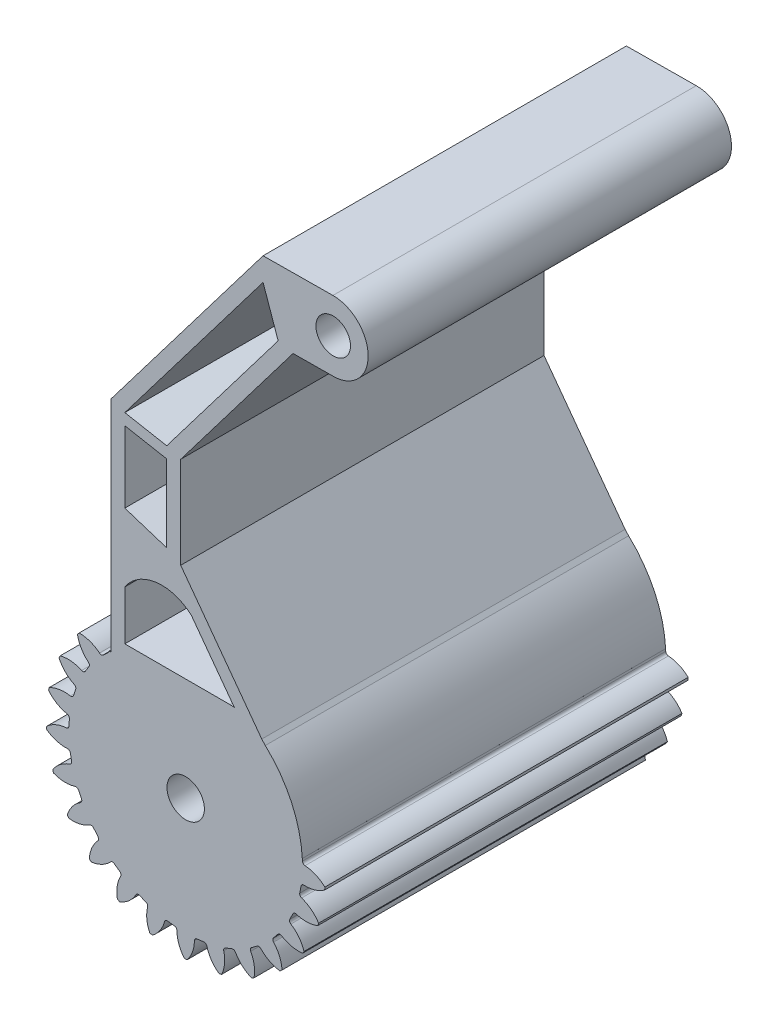
from build123d import *

# Parameters (mm, degrees)
SKETCH1_R                = 12.665001162
BOSS_EXTRUDE1_DEPTH      = 16.51
CUT_EXTRUDE1_DEPTH       = 25.359487041
FILLET1_R                = 0.255000023
CIRPATTERN1_COUNT        = 25
FILLET1_OF_CIRPATTERN1_R = 0.255000023
M3_CLEARANCE_HOLE1_D     = 3.4
SKETCH7_W                = 15.433030704
SKETCH7_H                = 5.386211439
CUT_EXTRUDE2_DEPTH       = 38.558904548
CLAW_PART_DEPTH          = 16.51
CLAW_PART_DEPTH_BACK     = 16.51
SKETCH8_R                = 1.57
CUT_EXTRUDE3_DEPTH       = 60.207872969


with BuildPart() as part:
    # Sketch1 → Boss-Extrude1 (new, symmetric)
    with BuildSketch(Plane.XY):
        Circle(SKETCH1_R)
    extrude(amount=BOSS_EXTRUDE1_DEPTH, both=True)

    # Sketch3 → Cut-Extrude1 (cut, symmetric)
    with BuildSketch(Plane.XY):
        with BuildLine():
            Line((-0.549568511, 10.61077849), (0.549568511, 10.61077849))
            ThreePointArc((0.549568511, 10.61077849), (1.298156627, 12.409330788), (3.016068488, 13.328000136))
            ThreePointArc((3.016068488, 13.328000136), (0, 13.665001162), (-3.016068488, 13.328000136))
            ThreePointArc((-3.016068488, 13.328000136), (-1.298156627, 12.409330788), (-0.549568511, 10.61077849))
        make_face()
    cut_extrude1 = extrude(amount=CUT_EXTRUDE1_DEPTH, both=True, mode=Mode.SUBTRACT)

    # Fillet1
    fillet1_edges = [part.edges().sort_by_distance(p)[0] for p in [
        (-0.549568511, 10.61077849, 0),
        (0.549568511, 10.61077849, 0),
    ]]
    fillet(fillet1_edges, radius=FILLET1_R)

    # CirPattern1: Cut-Extrude1 ×25 about axis, 7 skipped
    cirpattern1_axis = Axis((0, 0, 16.51), (0, 0, 1))
    add([cut_extrude1.rotate(cirpattern1_axis, i * 360 / CIRPATTERN1_COUNT) for i in range(1, CIRPATTERN1_COUNT) if i not in (1, 2, 20, 21, 22, 23, 24)], mode=Mode.SUBTRACT)

    # Fillet1 of CirPattern1
    fillet1_of_cirpattern1_edges = [part.edges().sort_by_distance(p)[0] for p in [
        (-7.66419591, 7.358719098, 0),
        (-6.862959504, 8.111130166, 0),
        (-9.253450125, 5.22152339, 0),
        (-8.664503057, 6.149555472, 0),
        (-10.261276036, 2.756240163, 0),
        (-9.921624017, 3.801581591, 0),
        (-10.624348235, 0.117772231, 0),
        (-10.55533285, 1.214740357, 0),
        (-10.319853561, -2.528095764, 0),
        (-10.525811301, -1.44842748, 0),
        (-9.366924534, -5.015114205, 0),
        (-9.834914317, -4.020585292, 0),
        (-7.82543719, -7.187014575, 0),
        (-8.526053496, -6.340114944, 0),
        (-5.792248847, -8.907328388, 0),
        (-6.681469377, -8.261271856, 0),
        (-3.395112206, -10.067962, 0),
        (-4.417063965, -9.663342675, 0),
        (-0.784648179, -10.595988531, 0),
        (-1.875118178, -10.458230134, 0),
        (1.875118178, -10.458230134, 0),
        (0.784648179, -10.595988531, 0),
        (4.417063965, -9.663342675, 0),
        (3.395112206, -10.067962, 0),
        (6.681469377, -8.261271856, 0),
        (5.792248847, -8.907328388, 0),
        (8.526053496, -6.340114944, 0),
        (7.82543719, -7.187014575, 0),
        (9.834914317, -4.020585292, 0),
        (9.366924534, -5.015114205, 0),
        (10.525811301, -1.44842748, 0),
        (10.319853561, -2.528095764, 0),
        (10.55533285, 1.214740357, 0),
        (10.624348235, 0.117772231, 0),
    ]]
    fillet(fillet1_of_cirpattern1_edges, radius=FILLET1_OF_CIRPATTERN1_R)

    # M3 Clearance Hole1 (through all)
    with Locations(Plane.XY.offset(16.51)):
        with Locations((0, 0)):
            Hole(M3_CLEARANCE_HOLE1_D / 2)

    # Sketch7 → Cut-Extrude2 (cut, through all)
    with BuildSketch(Plane.XY.offset(16.51)):
        with Locations((0.047493999, 10.802685467)):
            Rectangle(SKETCH7_W, SKETCH7_H)
    extrude(amount=-CUT_EXTRUDE2_DEPTH, mode=Mode.SUBTRACT)

    # Sketch8 → claw part (add, two sides: drawn at the far end of the back side and taken through both)
    with BuildSketch(Plane.XY.offset(-CLAW_PART_DEPTH_BACK)):
        with BuildLine():
            Line((3.992994947, 8.109579748), (-6.802497273, 8.109579748))
            Line((-6.802497273, 8.109579748), (-6.802497273, 28.011546875))
            Line((-6.802497273, 28.011546875), (7.032646368, 46.209579748))
            Line((7.032646368, 46.209579748), (13.382646368, 46.262410098))
            ThreePointArc((13.382646368, 46.262410098), (16.583950751, 43.113934237), (13.43547489, 39.912629854))
            Line((13.43547489, 39.912629854), (9.759859293, 39.882049687))
            Line((9.759859293, 39.882049687), (-0.452497273, 26.449243689))
            Line((-0.452497273, 26.449243689), (-0.452497273, 18.105340478))
            Line((-0.452497273, 18.105340478), (7.032646368, 7.951783594))
            Line((7.032646368, 7.951783594), (3.992994947, 8.109579748))
        make_face()
        with Locations((13.409060629, 43.087519976)):
            Circle(SKETCH8_R, mode=Mode.SUBTRACT)
        with BuildLine():
            Line((-5.532497273, 9.379579748), (-5.532497273, 13.862489028))
            ThreePointArc((-5.532497273, 13.862489028), (-2.677856166, 15.64723367), (0.531514386, 14.630262706))
            Line((0.531514386, 14.630262706), (4.417263537, 9.35926499))
            Line((4.417263537, 9.35926499), (4.025937257, 9.379579748))
            Line((4.025937257, 9.379579748), (-5.532497273, 9.379579748))
        make_face(mode=Mode.SUBTRACT)
        Polygon((-5.532497273, 27.583600596), (7.032646368, 44.111141108), (8.405146513, 40.198569154), (-1.722497273, 26.877189969), align=None, mode=Mode.SUBTRACT)
        Polygon((-1.722497273, 25.843874151), (-1.722497273, 18.840272222), (-5.532497273, 20.064062183), (-5.532497273, 26.550284777), align=None, mode=Mode.SUBTRACT)
    extrude(amount=CLAW_PART_DEPTH + CLAW_PART_DEPTH_BACK)

    # Sketch9 → Cut-Extrude3 (cut, through all)
    with BuildSketch(Plane.XY.offset(16.51)):
        with BuildLine():
            Line((6.916319953, 8.109579748), (7.234748251, 7.761896541))
            ThreePointArc((7.234748251, 7.761896541), (9.616723385, 4.484111006), (10.596386978, 0.552451967))
            Line((10.596386978, 0.552451967), (13.513134005, 1.97023997))
            Line((13.513134005, 1.97023997), (13.760629426, 4.432819406))
            Line((13.760629426, 4.432819406), (7.95686181, 10.69445355))
            Line((7.95686181, 10.69445355), (6.916319953, 8.109579748))
        make_face()
    extrude(amount=-CUT_EXTRUDE3_DEPTH, mode=Mode.SUBTRACT)


solid = part.part
